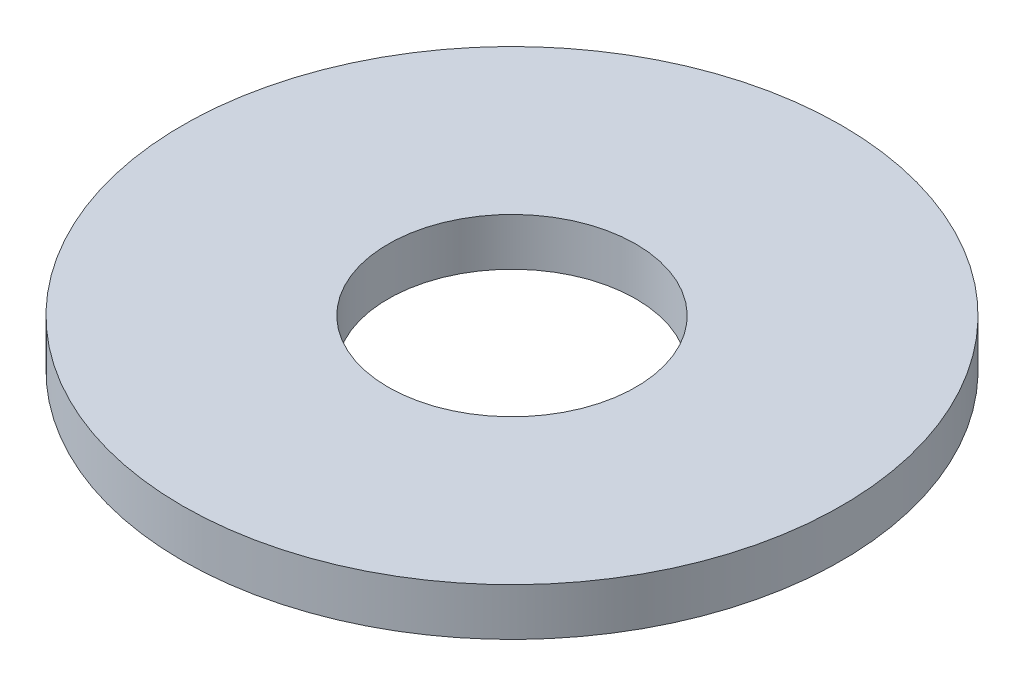
from build123d import *

# Parameters (mm, degrees)
SKETCH1_R           = 3.175
BOSS_EXTRUDE1_DEPTH = 0.4572
SKETCH5_R           = 1.1938
CUT_EXTRUDE1_DEPTH  = 5.513344862


with BuildPart() as part:
    # Sketch1 → Boss-Extrude1 (new body)
    with BuildSketch(Plane(origin=(0, 0, 0), x_dir=(1, 0, 0), z_dir=(0, 1, 0))):
        with Locations(Location((0, 0, 0), (0, 0, 270))):
            Circle(SKETCH1_R)
    extrude(amount=BOSS_EXTRUDE1_DEPTH)

    # Sketch5 → Cut-Extrude1 (cut, through all)
    with BuildSketch(Plane(origin=(0, 0.4572, 0), x_dir=(-1, 0, 0), z_dir=(0, 1, 0))):
        with Locations(Location((0, 0, 0), (0, 0, 90))):
            Circle(SKETCH5_R)
    extrude(amount=-CUT_EXTRUDE1_DEPTH, mode=Mode.SUBTRACT)


solid = part.part
